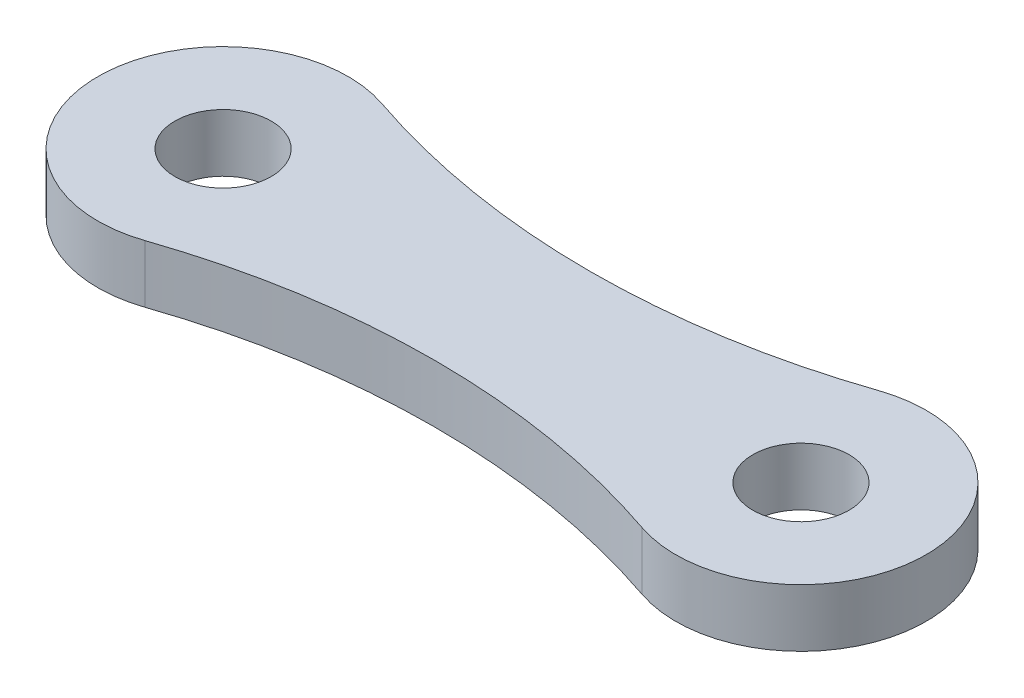
from build123d import *

# Parameters (mm, degrees)
SKETCH_1_R      = 2.5
EXTRUDE_1_DEPTH = 3


with BuildPart() as part:
    # 草图1 → 凸台-拉伸1 (new body)
    with BuildSketch(Plane(origin=(0, 0, 0), x_dir=(1, 0, 0), z_dir=(0, 1, 0))):
        with BuildLine():
            ThreePointArc((-12.903225806, 6.152522896), (-21.5, 0), (-12.903225806, -6.152522896))
            ThreePointArc((-12.903225806, -6.152522896), (0, -4.014202253), (12.903225806, -6.152522896))
            ThreePointArc((12.903225806, -6.152522896), (21.5, 0), (12.903225806, 6.152522896))
            ThreePointArc((12.903225806, 6.152522896), (0, 4.014202253), (-12.903225806, 6.152522896))
        make_face()
        with Locations(Location((-15, 0, 0), (0, 0, 270))):
            Circle(SKETCH_1_R, mode=Mode.SUBTRACT)
        with Locations(Location((15, 0, 0), (0, 0, 90))):
            Circle(SKETCH_1_R, mode=Mode.SUBTRACT)
    extrude(amount=EXTRUDE_1_DEPTH)


solid = part.part
